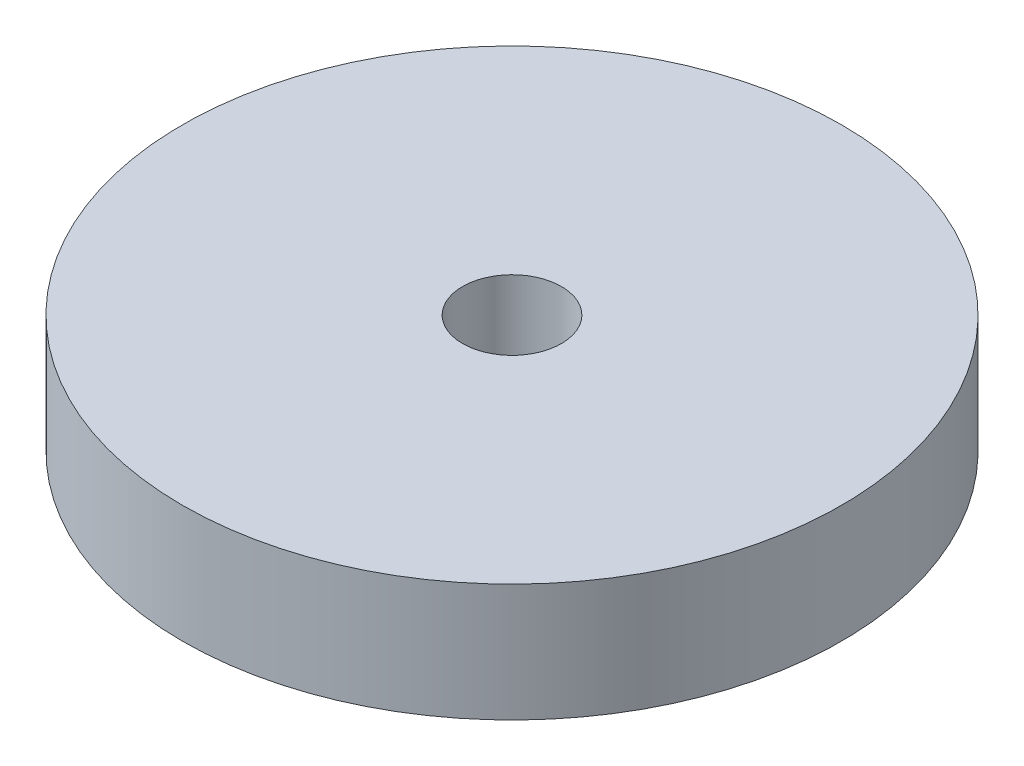
from build123d import *

# Parameters (mm, degrees)
SKETCH1_R           = 14
SKETCH1_R_2         = 2.1
BOSS_EXTRUDE1_DEPTH = 2.5


with BuildPart() as part:
    # Sketch1 → Boss-Extrude1 (new, symmetric)
    with BuildSketch(Plane(origin=(0, 0, 0), x_dir=(1, 0, 0), z_dir=(0, 1, 0))):
        with Locations(Location((0, 0, 0), (0, 0, 270))):
            Circle(SKETCH1_R)
        with Locations(Location((0, 0, 0), (0, 0, 270))):
            Circle(SKETCH1_R_2, mode=Mode.SUBTRACT)
    extrude(amount=BOSS_EXTRUDE1_DEPTH, both=True)


solid = part.part
